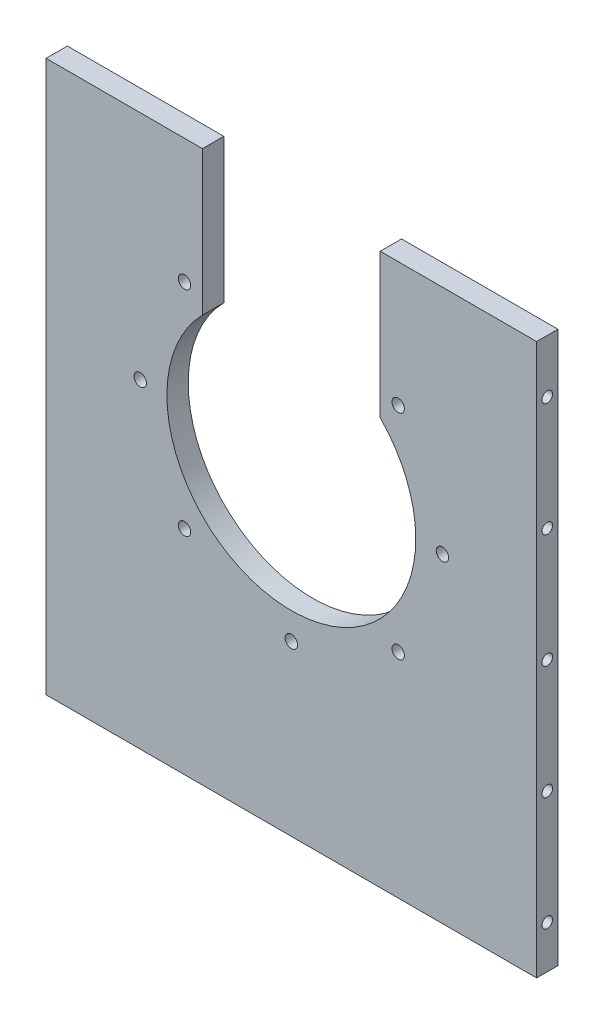
from build123d import *

# Parameters (mm, degrees)
SKETCH_1_W          = 138
SKETCH_1_H          = 180
SKETCH_1_R          = 1.75
SKETCH_1_R_2        = 35
EXTRUDE_1_DEPTH     = 6
SKETCH_2_W          = 50
SKETCH_2_H          = 50
CUT_EXTRUDE_1_DEPTH = 10
SKETCH_4_W          = 185.340515344
SKETCH_4_H          = 73.1161564
CUT_EXTRUDE_3_DEPTH = 10
SKETCH_3_R          = 1.5
CUT_EXTRUDE_2_DEPTH = 15


with BuildPart() as part:
    # 草图1 → 凸台-拉伸1 (new body)
    with BuildSketch(Plane.XY):
        Rectangle(SKETCH_1_W, SKETCH_1_H)
        with Locations((0, 42.5)):
            Circle(SKETCH_1_R, mode=Mode.SUBTRACT)
        with Locations((30.0520382, 30.0520382)):
            Circle(SKETCH_1_R, mode=Mode.SUBTRACT)
        with Locations((42.5, 0)):
            Circle(SKETCH_1_R, mode=Mode.SUBTRACT)
        with Locations((30.0520382, -30.0520382)):
            Circle(SKETCH_1_R, mode=Mode.SUBTRACT)
        with Locations((0, -42.5)):
            Circle(SKETCH_1_R, mode=Mode.SUBTRACT)
        with Locations((-30.0520382, -30.0520382)):
            Circle(SKETCH_1_R, mode=Mode.SUBTRACT)
        with Locations((-42.5, 0)):
            Circle(SKETCH_1_R, mode=Mode.SUBTRACT)
        with Locations((-30.0520382, 30.0520382)):
            Circle(SKETCH_1_R, mode=Mode.SUBTRACT)
        Circle(SKETCH_1_R_2, mode=Mode.SUBTRACT)
    extrude(amount=EXTRUDE_1_DEPTH)

    # 草图2 → 切除-拉伸1 (cut)
    with BuildSketch(Plane(origin=(0, 0, 0), x_dir=(-1, 0, 0), z_dir=(0, 0, -1))):
        with Locations((0, 45)):
            Rectangle(SKETCH_2_W, SKETCH_2_H)
    extrude(amount=-CUT_EXTRUDE_1_DEPTH, mode=Mode.SUBTRACT)

    # 草图4 → 切除-拉伸3 (cut)
    with BuildSketch(Plane(origin=(0, 0, 0), x_dir=(-1, 0, 0), z_dir=(0, 0, -1))):
        with Locations((5.331713455, 101.6101164)):
            Rectangle(SKETCH_4_W, SKETCH_4_H)
    extrude(amount=-CUT_EXTRUDE_3_DEPTH, mode=Mode.SUBTRACT)

    # 草图3 → 切除-拉伸2 (cut)
    with BuildSketch(Plane.ZY.offset(69)):
        with Locations(Location((3, 50.0520382, 0), (0, 0, 270))):
            Circle(SKETCH_3_R)
        with Locations(Location((3, 18.0520382, 0), (0, 0, 270))):
            Circle(SKETCH_3_R)
        with Locations(Location((3, -13.9479618, 0), (0, 0, 270))):
            Circle(SKETCH_3_R)
        with Locations(Location((3, -45.9479618, 0), (0, 0, 270))):
            Circle(SKETCH_3_R)
        with Locations(Location((3, -77.9479618, 0), (0, 0, 270))):
            Circle(SKETCH_3_R)
    cut_extrude_2 = extrude(amount=-CUT_EXTRUDE_2_DEPTH, mode=Mode.SUBTRACT)

    # 镜向1: 切除-拉伸2 across plane
    add(cut_extrude_2.mirror(Plane.ZY), mode=Mode.SUBTRACT)


solid = part.part
